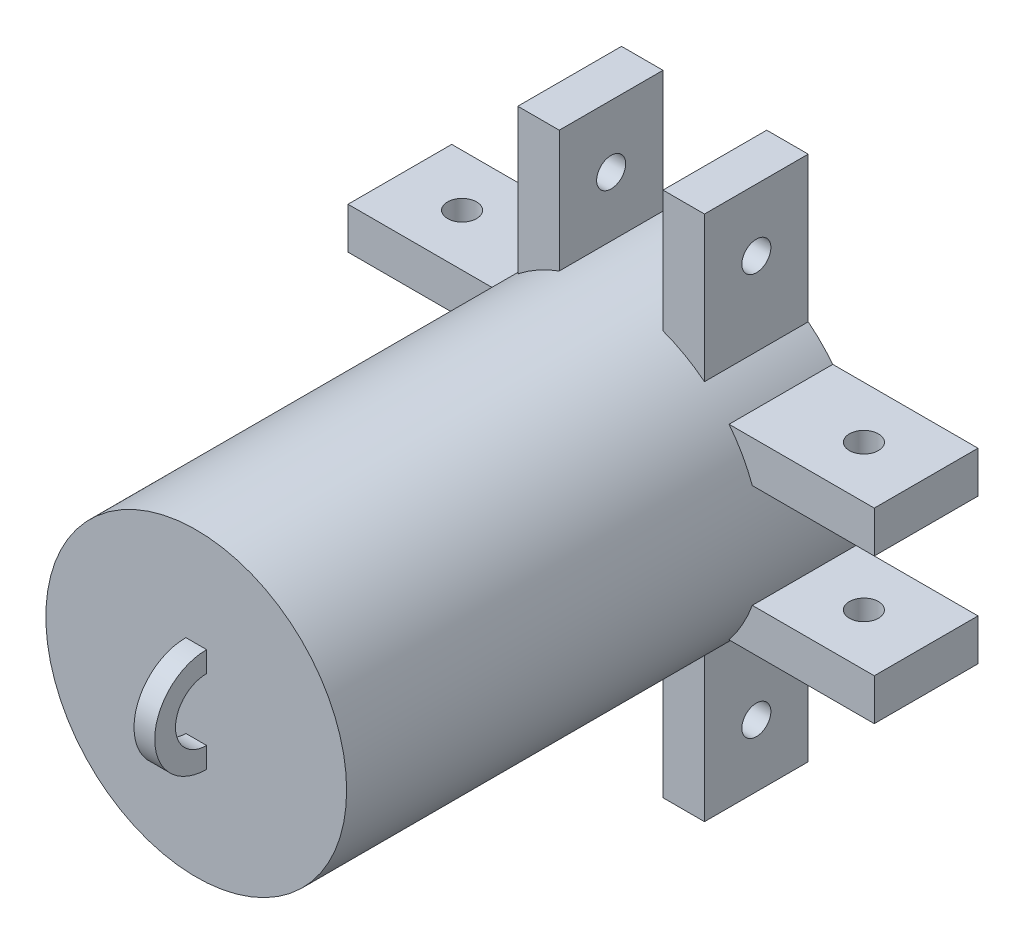
from build123d import *
from build123d.topology import SkipClean

# Parameters (mm, degrees)
SKETCH1_R                = 18.415
BOSS_EXTRUDE1_DEPTH      = 63.5
BOSS_EXTRUDE4_DEPTH      = 12.7
SKETCH9_R                = 1.778
CUT_EXTRUDE2_DEPTH       = 25.4
BOSS_EXTRUDE5_DEPTH      = 1.27
BOSS_EXTRUDE5_DEPTH_BACK = 1.27
CUT_EXTRUDE3_DEPTH       = 15.24
CUT_EXTRUDE4_START       = -12.7
CUT_EXTRUDE4_DEPTH       = 12.7
CIRPATTERN1_COUNT        = 4


with BuildPart() as part:
    # Sketch1 → Boss-Extrude1 (new body)
    with BuildSketch(Plane.XY):
        Circle(SKETCH1_R)
    extrude(amount=BOSS_EXTRUDE1_DEPTH)

    # Sketch8 → Boss-Extrude4 (add)
    with BuildSketch(Plane.XY):
        with BuildLine():
            Line((-14.438397591, 11.43), (-32.218397591, 11.43))
            Line((-32.218397591, 11.43), (-32.218397591, -11.43))
            Line((-32.218397591, -11.43), (-14.438397591, -11.43))
            ThreePointArc((-14.438397591, -11.43), (-18.415, 0), (-14.438397591, 11.43))
        make_face()
    boss_extrude4 = extrude(amount=BOSS_EXTRUDE4_DEPTH)

    # Sketch9 → Cut-Extrude2 (cut)
    with BuildSketch(Plane.XZ.offset(11.43)):
        with Locations(Location((-24.598397591, 6.35, 0), (0, 0, 270))):
            Circle(SKETCH9_R)
    cut_extrude2 = extrude(amount=-CUT_EXTRUDE2_DEPTH, mode=Mode.SUBTRACT)

    # Sketch13 → Boss-Extrude5 (add, two sides: drawn at the far end of the back side and taken through both)
    with BuildSketch(Plane(origin=(0, 0, 0), x_dir=(0, 0, -1), z_dir=(1, 0, 0)).offset(-BOSS_EXTRUDE5_DEPTH_BACK)):
        with BuildLine():
            Line((-63.5, 6.35), (-63.5, -6.35))
            ThreePointArc((-63.5, -6.35), (-69.85, 0), (-63.5, 6.35))
        make_face()
    extrude(amount=BOSS_EXTRUDE5_DEPTH + BOSS_EXTRUDE5_DEPTH_BACK)

    # Sketch14 → Cut-Extrude3 (cut)
    with BuildSketch(Plane(origin=(1.27, 0, 0), x_dir=(0, 0, -1), z_dir=(1, 0, 0))):
        with BuildLine():
            Line((-63.5, 3.81), (-63.5, -3.81))
            ThreePointArc((-63.5, -3.81), (-67.31, 0), (-63.5, 3.81))
        make_face()
    extrude(amount=-CUT_EXTRUDE3_DEPTH, mode=Mode.SUBTRACT)

    # Sketch15 → Cut-Extrude4 (cut)
    with SkipClean():  # the faces are left unmerged after this step: merging them gives an invalid solid
        with BuildSketch(Plane.XY.offset(12.7).offset(CUT_EXTRUDE4_START)):
            with BuildLine():
                Line((-17.285535138, 6.35), (-32.218397591, 6.35))
                Line((-32.218397591, 6.35), (-32.218397591, -6.35))
                Line((-32.218397591, -6.35), (-17.285535138, -6.35))
                ThreePointArc((-17.285535138, -6.35), (-18.415, 0), (-17.285535138, 6.35))
            make_face()
        cut_extrude4 = extrude(amount=CUT_EXTRUDE4_DEPTH, mode=Mode.SUBTRACT)

    # CirPattern1: Boss-Extrude4, Cut-Extrude2, Cut-Extrude4 ×4 about axis
    with SkipClean():  # the faces are left unmerged after this step: merging them gives an invalid solid
        cirpattern1_axis = Axis((0, 0, 0), (0, 0, 1))
        add([boss_extrude4.rotate(cirpattern1_axis, i * 360 / CIRPATTERN1_COUNT) for i in range(1, CIRPATTERN1_COUNT)])
        add([cut_extrude2.rotate(cirpattern1_axis, i * 360 / CIRPATTERN1_COUNT) for i in range(1, CIRPATTERN1_COUNT)], mode=Mode.SUBTRACT)
        add([cut_extrude4.rotate(cirpattern1_axis, i * 360 / CIRPATTERN1_COUNT) for i in range(1, CIRPATTERN1_COUNT)], mode=Mode.SUBTRACT)


solid = part.part
